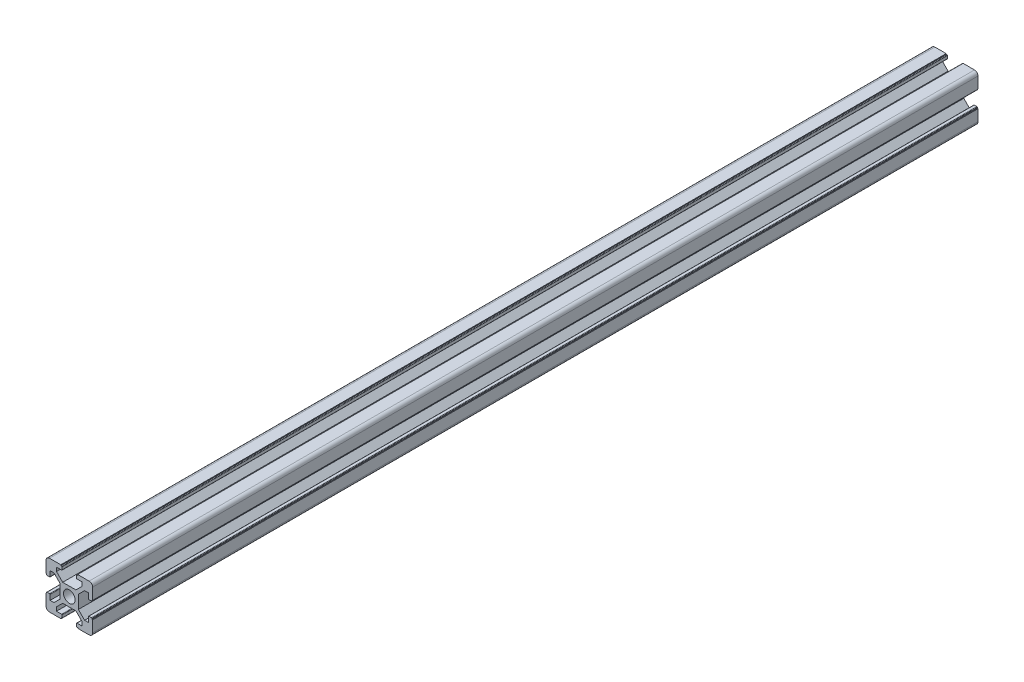
from build123d import *

# Parameters (mm, degrees)
SKETCH_1_R      = 2.5
EXTRUDE_2_DEPTH = 380
EXTRUDE_3_DEPTH = 380


with BuildPart() as part:
    # 草图1 → 凸台-拉伸2 (new body)
    with BuildSketch(Plane.XY):
        with BuildLine():
            Line((3.65, 10), (8.5, 10))
            ThreePointArc((8.5, 10), (9.560660172, 9.560660172), (10, 8.5))
            Line((10, 8.5), (10, 3.65))
            Line((10, 3.65), (8.2, 3.65))
            Line((8.2, 3.65), (8.2, 5.5))
            Line((8.2, 5.5), (6.560660172, 5.5))
            Line((6.560660172, 5.5), (3.9, 2.839339828))
            Line((3.9, 2.839339828), (3.9, -2.839339828))
            Line((3.9, -2.839339828), (6.560660172, -5.5))
            Line((6.560660172, -5.5), (8.2, -5.5))
            Line((8.2, -5.5), (8.2, -3.65))
            Line((8.2, -3.65), (10, -3.65))
            Line((10, -3.65), (10, -8.5))
            ThreePointArc((10, -8.5), (9.560660172, -9.560660172), (8.5, -10))
            Line((8.5, -10), (3.65, -10))
            Line((3.65, -10), (3.65, -8.2))
            Line((3.65, -8.2), (5.5, -8.2))
            Line((5.5, -8.2), (5.5, -6.560660172))
            Line((5.5, -6.560660172), (2.839339828, -3.9))
            Line((2.839339828, -3.9), (-2.839339828, -3.9))
            Line((-2.839339828, -3.9), (-5.5, -6.560660172))
            Line((-5.5, -6.560660172), (-5.5, -8.2))
            Line((-5.5, -8.2), (-3.65, -8.2))
            Line((-3.65, -8.2), (-3.65, -10))
            Line((-3.65, -10), (-8.5, -10))
            ThreePointArc((-8.5, -10), (-9.560660172, -9.560660172), (-10, -8.5))
            Line((-10, -8.5), (-10, -3.65))
            Line((-10, -3.65), (-8.2, -3.65))
            Line((-8.2, -3.65), (-8.2, -5.5))
            Line((-8.2, -5.5), (-6.560660172, -5.5))
            Line((-6.560660172, -5.5), (-3.9, -2.839339828))
            Line((-3.9, -2.839339828), (-3.9, 2.839339828))
            Line((-3.9, 2.839339828), (-6.560660172, 5.5))
            Line((-6.560660172, 5.5), (-8.2, 5.5))
            Line((-8.2, 5.5), (-8.2, 3.65))
            Line((-8.2, 3.65), (-10, 3.65))
            Line((-10, 3.65), (-10, 8.5))
            ThreePointArc((-10, 8.5), (-9.560660172, 9.560660172), (-8.5, 10))
            Line((-8.5, 10), (-3.65, 10))
            Line((-3.65, 10), (-3.65, 8.2))
            Line((-3.65, 8.2), (-5.5, 8.2))
            Line((-5.5, 8.2), (-5.5, 6.560660172))
            Line((-5.5, 6.560660172), (-2.839339828, 3.9))
            Line((-2.839339828, 3.9), (2.839339828, 3.9))
            Line((2.839339828, 3.9), (5.5, 6.560660172))
            Line((5.5, 6.560660172), (5.5, 8.2))
            Line((5.5, 8.2), (3.65, 8.2))
            Line((3.65, 8.2), (3.65, 10))
        make_face()
        Circle(SKETCH_1_R, mode=Mode.SUBTRACT)
    extrude(amount=EXTRUDE_2_DEPTH)

    # 草图3 → 凸台-拉伸3 (add)
    with BuildSketch(Plane.XY.offset(380)):
        with BuildLine():
            Line((-8.2, 3.65), (-9.7, 3.65))
            Line((-9.7, 3.65), (-9.7, 3.3))
            ThreePointArc((-9.7, 3.3), (-9.641421356, 3.158578644), (-9.5, 3.1))
            Line((-9.5, 3.1), (-8.4, 3.1))
            ThreePointArc((-8.4, 3.1), (-8.258578644, 3.158578644), (-8.2, 3.3))
            Line((-8.2, 3.3), (-8.2, 3.65))
        make_face()
        with BuildLine():
            Line((-3.65, 9.7), (-3.65, 8.2))
            Line((-3.65, 8.2), (-3.3, 8.2))
            ThreePointArc((-3.3, 8.2), (-3.158578644, 8.258578644), (-3.1, 8.4))
            Line((-3.1, 8.4), (-3.1, 9.5))
            ThreePointArc((-3.1, 9.5), (-3.158578644, 9.641421356), (-3.3, 9.7))
            Line((-3.3, 9.7), (-3.65, 9.7))
        make_face()
        with BuildLine():
            Line((3.65, 8.2), (3.65, 9.7))
            Line((3.65, 9.7), (3.3, 9.7))
            ThreePointArc((3.3, 9.7), (3.158578644, 9.641421356), (3.1, 9.5))
            Line((3.1, 9.5), (3.1, 8.4))
            ThreePointArc((3.1, 8.4), (3.158578644, 8.258578644), (3.3, 8.2))
            Line((3.3, 8.2), (3.65, 8.2))
        make_face()
        with BuildLine():
            Line((9.7, 3.65), (8.2, 3.65))
            Line((8.2, 3.65), (8.2, 3.3))
            ThreePointArc((8.2, 3.3), (8.258578644, 3.158578644), (8.4, 3.1))
            Line((8.4, 3.1), (9.5, 3.1))
            ThreePointArc((9.5, 3.1), (9.641421356, 3.158578644), (9.7, 3.3))
            Line((9.7, 3.3), (9.7, 3.65))
        make_face()
        with BuildLine():
            Line((3.65, -9.7), (3.65, -8.2))
            Line((3.65, -8.2), (3.3, -8.2))
            ThreePointArc((3.3, -8.2), (3.158578644, -8.258578644), (3.1, -8.4))
            Line((3.1, -8.4), (3.1, -9.5))
            ThreePointArc((3.1, -9.5), (3.158578644, -9.641421356), (3.3, -9.7))
            Line((3.3, -9.7), (3.65, -9.7))
        make_face()
        with BuildLine():
            Line((-3.65, -8.2), (-3.65, -9.7))
            Line((-3.65, -9.7), (-3.3, -9.7))
            ThreePointArc((-3.3, -9.7), (-3.158578644, -9.641421356), (-3.1, -9.5))
            Line((-3.1, -9.5), (-3.1, -8.4))
            ThreePointArc((-3.1, -8.4), (-3.158578644, -8.258578644), (-3.3, -8.2))
            Line((-3.3, -8.2), (-3.65, -8.2))
        make_face()
        with BuildLine():
            Line((8.2, -3.65), (8.2, -3.3))
            ThreePointArc((8.2, -3.3), (8.258578644, -3.158578644), (8.4, -3.1))
            Line((8.4, -3.1), (9.5, -3.1))
            ThreePointArc((9.5, -3.1), (9.641421356, -3.158578644), (9.7, -3.3))
            Line((9.7, -3.3), (9.7, -3.65))
            Line((9.7, -3.65), (8.2, -3.65))
        make_face()
        with BuildLine():
            Line((-8.2, -3.65), (-8.2, -3.3))
            ThreePointArc((-8.2, -3.3), (-8.258578644, -3.158578644), (-8.4, -3.1))
            Line((-8.4, -3.1), (-9.5, -3.1))
            ThreePointArc((-9.5, -3.1), (-9.641421356, -3.158578644), (-9.7, -3.3))
            Line((-9.7, -3.3), (-9.7, -3.65))
            Line((-9.7, -3.65), (-8.2, -3.65))
        make_face()
    extrude(amount=-EXTRUDE_3_DEPTH)


solid = part.part
